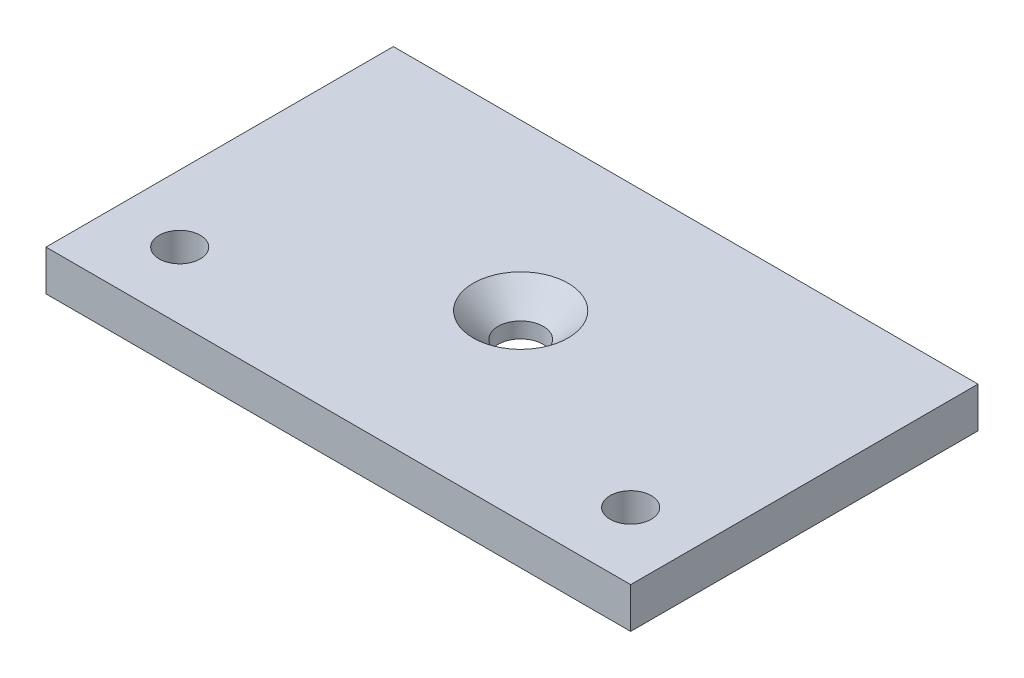
from build123d import *

# Parameters (mm, degrees)
SKETCH1_W                                      = 50.5
SKETCH1_H                                      = 51.5
SKETCH1_R                                      = 1.775
BOSS_EXTRUDE1_DEPTH                            = 3.5
CSK_FOR_M3_5_FLAT_HEAD_MACHINE_SCREW1_AT_COUNT = 2
CSK_FOR_M3_5_FLAT_HEAD_MACHINE_SCREW1_AT_PITCH = 20


with BuildPart() as part:
    # Sketch1 → Boss-Extrude1 (new body)
    with BuildSketch(Plane(origin=(0, 0, 0), x_dir=(1, 0, 0), z_dir=(0, 1, 0))):
        Rectangle(SKETCH1_W, SKETCH1_H)
        with Locations(Location((-19.475, 19.975, 0), (0, 0, 270))):
            Circle(SKETCH1_R, mode=Mode.SUBTRACT)
        with Locations(Location((19.475, 19.975, 0), (0, 0, 270))):
            Circle(SKETCH1_R, mode=Mode.SUBTRACT)
        with Locations(Location((19.475, -19.975, 0), (0, 0, 270))):
            Circle(SKETCH1_R, mode=Mode.SUBTRACT)
        with Locations(Location((-19.475, -19.975, 0), (0, 0, 270))):
            Circle(SKETCH1_R, mode=Mode.SUBTRACT)
    extrude(amount=BOSS_EXTRUDE1_DEPTH)

    # Sketch4 → CSK for M3.5 Flat Head Machine Screw1 (revolve, cut)
    with BuildSketch(Plane(origin=(0, 3.5, -10), x_dir=(0, 0, 1), z_dir=(1, 0, 0))):
        Polygon((0, 0), (0, 3.5), (1.95, 3.5), (1.95, 2.15), (4.1, 0), align=None)
    csk_for_m3_5_flat_head_machine_screw1 = revolve(axis=Axis((0, 9.85, -10), (0, -1, 0)), mode=Mode.SUBTRACT)

    # CSK for M3.5 Flat Head Machine Screw1 at: CSK for M3.5 Flat Head Machine Screw1 ×2
    with Locations(*[(0, 0, i * CSK_FOR_M3_5_FLAT_HEAD_MACHINE_SCREW1_AT_PITCH) for i in range(1, CSK_FOR_M3_5_FLAT_HEAD_MACHINE_SCREW1_AT_COUNT)]):
        add(csk_for_m3_5_flat_head_machine_screw1, mode=Mode.SUBTRACT)

    # Split1
    split(bisect_by=Plane.XY.offset(-4.25), keep=Keep.TOP)


solid = part.part
